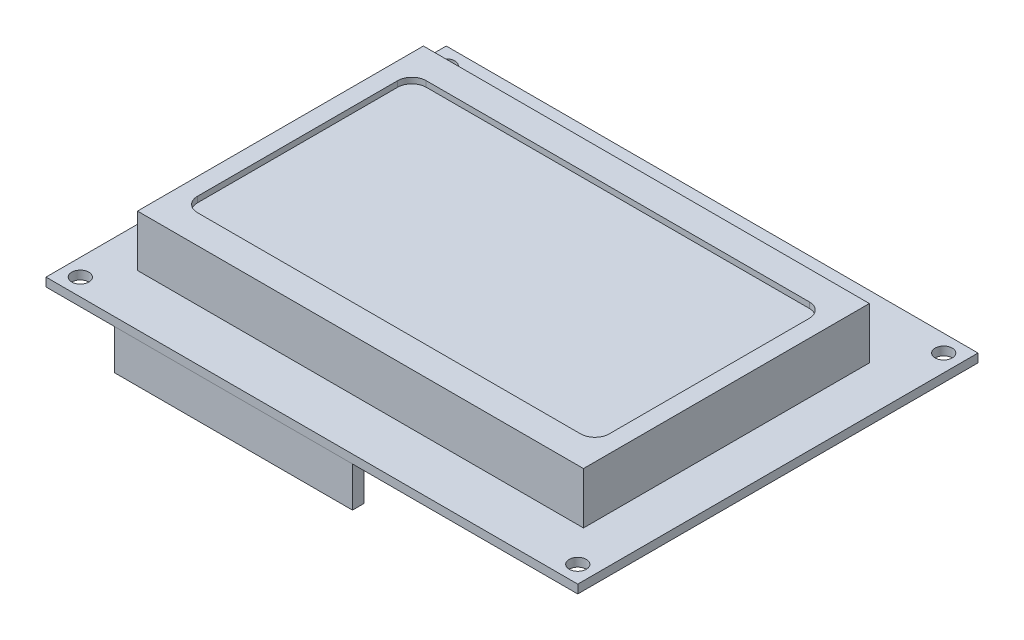
from build123d import *

# Parameters (mm, degrees)
SKETCH1_W           = 93
SKETCH1_H           = 70
BOSS_EXTRUDE1_DEPTH = 1.5
SKETCH2_W           = 78
SKETCH2_H           = 50
BOSS_EXTRUDE2_DEPTH = 9
CUT_EXTRUDE1_DEPTH  = 1
SKETCH4_R           = 1.5
CUT_EXTRUDE2_DEPTH  = 117.747590982
SKETCH5_W           = 41.6
SKETCH5_H           = 2
BOSS_EXTRUDE3_DEPTH = 7


with BuildPart() as part:
    # Sketch1 → Boss-Extrude1 (new body)
    with BuildSketch(Plane(origin=(0, 0, 0), x_dir=(1, 0, 0), z_dir=(0, 1, 0))):
        with Locations((46.5, 35)):
            Rectangle(SKETCH1_W, SKETCH1_H)
    extrude(amount=BOSS_EXTRUDE1_DEPTH)

    # Sketch2 → Boss-Extrude2 (add)
    with BuildSketch(Plane(origin=(0, 1.5, 0), x_dir=(1, 0, 0), z_dir=(0, 1, 0))):
        with Locations((46, 34)):
            Rectangle(SKETCH2_W, SKETCH2_H)
    extrude(amount=BOSS_EXTRUDE2_DEPTH)

    # Sketch3 → Cut-Extrude1 (cut)
    with BuildSketch(Plane(origin=(0, 10.5, 0), x_dir=(1, 0, 0), z_dir=(0, 1, 0))):
        with BuildLine():
            Line((12.5, 54), (79.5, 54))
            ThreePointArc((79.5, 54), (81.267766953, 53.267766953), (82, 51.5))
            Line((82, 51.5), (82, 16.5))
            ThreePointArc((82, 16.5), (81.267766953, 14.732233047), (79.5, 14))
            Line((79.5, 14), (12.5, 14))
            ThreePointArc((12.5, 14), (10.732233047, 14.732233047), (10, 16.5))
            Line((10, 16.5), (10, 51.5))
            ThreePointArc((10, 51.5), (10.732233047, 53.267766953), (12.5, 54))
        make_face()
    extrude(amount=-CUT_EXTRUDE1_DEPTH, mode=Mode.SUBTRACT)

    # Sketch4 → Cut-Extrude2 (cut, through all)
    with BuildSketch(Plane(origin=(0, 1.5, 0), x_dir=(1, 0, 0), z_dir=(0, 1, 0))):
        with Locations(Location((3, 67, 0), (0, 0, 270))):
            Circle(SKETCH4_R)
        with Locations(Location((90, 67, 0), (0, 0, 270))):
            Circle(SKETCH4_R)
        with Locations(Location((90, 3, 0), (0, 0, 270))):
            Circle(SKETCH4_R)
        with Locations(Location((3, 3, 0), (0, 0, 270))):
            Circle(SKETCH4_R)
    extrude(amount=-CUT_EXTRUDE2_DEPTH, mode=Mode.SUBTRACT)


with BuildPart() as body_2:
    # Sketch5 → Boss-Extrude3 (new body)
    with BuildSketch(Plane.XZ):
        with Locations((32.8, -1)):
            Rectangle(SKETCH5_W, SKETCH5_H)
    extrude(amount=BOSS_EXTRUDE3_DEPTH)


solid = Compound([part.part, body_2.part])
